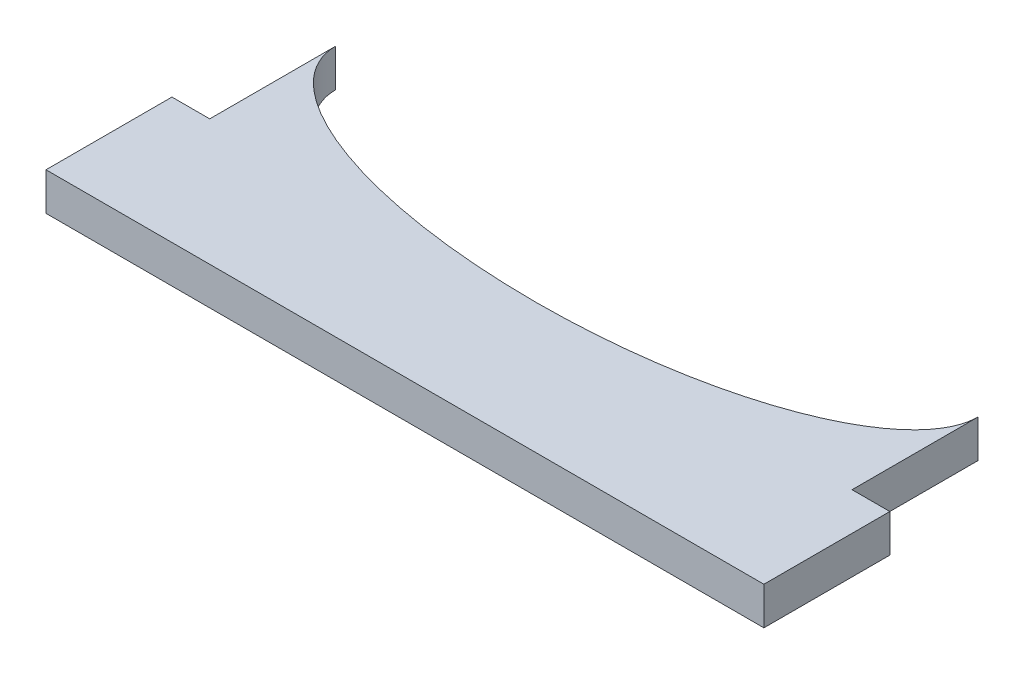
from build123d import *

# Parameters (mm, degrees)
BOSS_EXTRUDE1_DEPTH = 3


with BuildPart() as part:
    # Sketch2 → Boss-Extrude1 (new body)
    with BuildSketch(Plane(origin=(0, 0, 0), x_dir=(1, 0, 0), z_dir=(0, 1, 0))):
        with BuildLine():
            Line((25.5, 0), (25.5, 10.336529865))
            add(Edge.make_bspline(
                [(0, 20), (0, 10.336529865), (25.5, 10.336529865)],
                knots=[3.141592654, 3.141592654, 3.141592654, 4.71238898, 4.71238898, 4.71238898], degree=2, weights=[1, 0.707106781, 1]))
            Line((0, 20), (0, 10))
            Line((0, 10), (-3, 10))
            Line((-3, 10), (-3, 0))
            Line((-3, 0), (0, 0))
            Line((0, 0), (25.5, 0))
        make_face()
        with BuildLine():
            add(Edge.make_bspline(
                [(25.5, 10.336529865), (51, 10.336529865), (51, 20)],
                knots=[4.71238898, 4.71238898, 4.71238898, 6.283185307, 6.283185307, 6.283185307], degree=2, weights=[1, 0.707106781, 1]))
            Line((25.5, 10.336529865), (25.5, 0))
            Line((25.5, 0), (51, 0))
            Line((51, 0), (54, 0))
            Line((54, 0), (54, 10))
            Line((54, 10), (51, 10))
            Line((51, 10), (51, 20))
        make_face()
    extrude(amount=BOSS_EXTRUDE1_DEPTH)


solid = part.part
